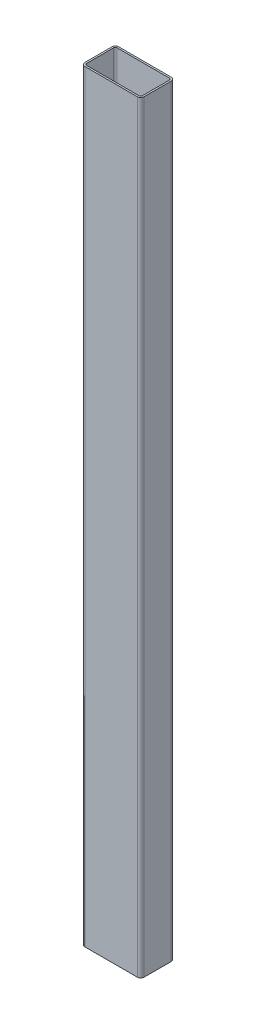
from build123d import *

# Parameters (mm, degrees)
BOSS_EXTRU_1_DEPTH = 450


with BuildPart() as part:
    # Esquisse1 → Boss.-Extru.1 (new body)
    with BuildSketch(Plane(origin=(0, 0, 0), x_dir=(1, 0, 0), z_dir=(0, 1, 0))):
        with BuildLine():
            Line((15.5, -10), (-15.5, -10))
            ThreePointArc((-15.5, -10), (-16.914213562, -9.414213562), (-17.5, -8))
            Line((-17.5, -8), (-17.5, 8))
            ThreePointArc((-17.5, 8), (-16.914213562, 9.414213562), (-15.5, 10))
            Line((-15.5, 10), (15.5, 10))
            ThreePointArc((15.5, 10), (16.914213562, 9.414213562), (17.5, 8))
            Line((17.5, 8), (17.5, -8))
            ThreePointArc((17.5, -8), (16.914213562, -9.414213562), (15.5, -10))
        make_face()
        with BuildLine():
            Line((15.5, -9), (-15.5, -9))
            ThreePointArc((-15.5, -9), (-16.207106781, -8.707106781), (-16.5, -8))
            Line((-16.5, -8), (-16.5, 8))
            ThreePointArc((-16.5, 8), (-16.207106781, 8.707106781), (-15.5, 9))
            Line((-15.5, 9), (15.5, 9))
            ThreePointArc((15.5, 9), (16.207106781, 8.707106781), (16.5, 8))
            Line((16.5, 8), (16.5, -8))
            ThreePointArc((16.5, -8), (16.207106781, -8.707106781), (15.5, -9))
        make_face(mode=Mode.SUBTRACT)
    extrude(amount=BOSS_EXTRU_1_DEPTH)


solid = part.part
